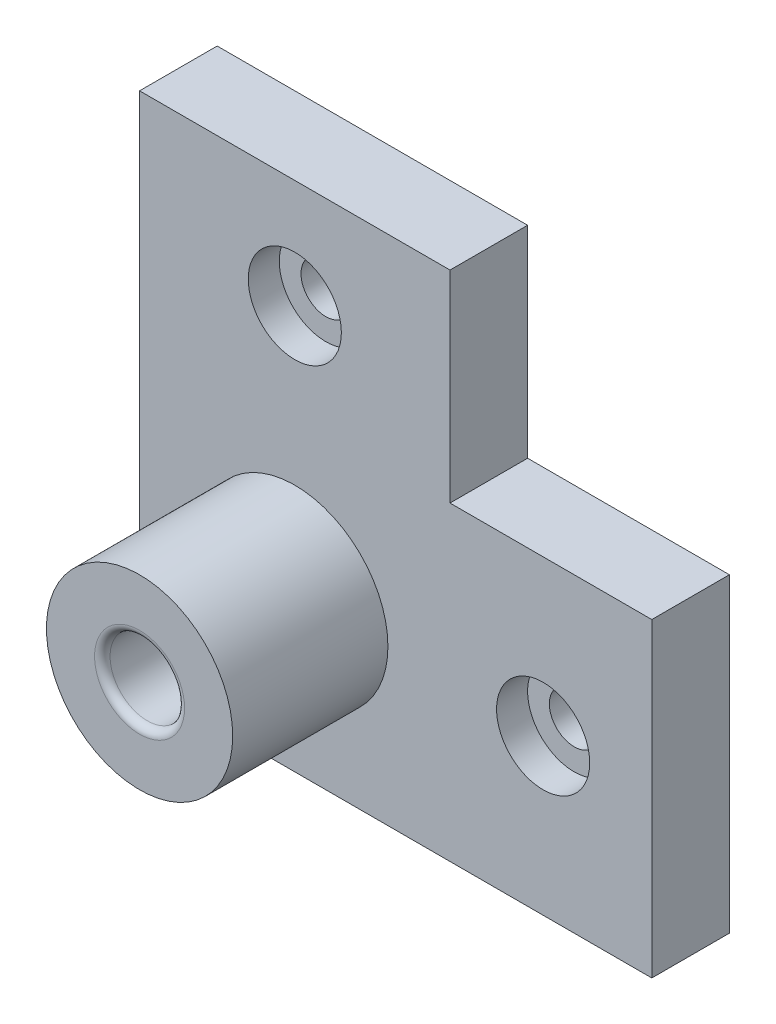
from build123d import *

# Parameters (mm, degrees)
SKETCH_1_W          = 20
SKETCH_1_H          = 20
SKETCH_1_H_2        = 13
SKETCH_1_R          = 1.6
SKETCH_1_W_2        = 13
EXTRUDE_1_DEPTH     = 5
SKETCH_2_R          = 6
EXTRUDE_2_DEPTH     = 10
SKETCH_3_R          = 2.4
CUT_EXTRUDE_1_DEPTH = 50.020403915
SKETCH_4_R          = 3
CUT_EXTRUDE_2_DEPTH = 2
FILLET_1_R          = 0.5


with BuildPart() as part:
    # 草图1 → 凸台-拉伸1 (new body)
    # profile 1 of 3: a face of its own
    with BuildSketch(Plane.XY):
        with Locations((10, 10)):
            Rectangle(SKETCH_1_W, SKETCH_1_H)
    # profile 2 of 3: a face of its own
    with BuildSketch(Plane.XY):
        with Locations((10, 26.5)):
            Rectangle(SKETCH_1_W, SKETCH_1_H_2)
        with Locations((10, 26)):
            Circle(SKETCH_1_R, mode=Mode.SUBTRACT)
    # profile 3 of 3: a face of its own
    with BuildSketch(Plane.XY):
        with Locations((26.5, 10)):
            Rectangle(SKETCH_1_W_2, SKETCH_1_H)
        with Locations((26, 10)):
            Circle(SKETCH_1_R, mode=Mode.SUBTRACT)
    extrude(amount=EXTRUDE_1_DEPTH)

    # 草图2 → 凸台-拉伸2 (add)
    with BuildSketch(Plane.XY.offset(5)):
        with Locations((10, 10)):
            Circle(SKETCH_2_R)
    extrude(amount=EXTRUDE_2_DEPTH)

    # 草图3 → 切除-拉伸1 (cut, through all)
    with BuildSketch(Plane.XY.offset(15)):
        with Locations((10, 10)):
            Circle(SKETCH_3_R)
    extrude(amount=-CUT_EXTRUDE_1_DEPTH, mode=Mode.SUBTRACT)

    # 草图4 → 切除-拉伸2 (cut)
    with BuildSketch(Plane.XY.offset(5)):
        with Locations((10, 26)):
            Circle(SKETCH_4_R)
        with Locations((26, 10)):
            Circle(SKETCH_4_R)
    extrude(amount=-CUT_EXTRUDE_2_DEPTH, mode=Mode.SUBTRACT)

    # 圆角1
    fillet_1_edges = [part.edges().sort_by_distance(p)[0] for p in [
        (7.6, 10, 15),
    ]]
    fillet(fillet_1_edges, radius=FILLET_1_R)


solid = part.part
